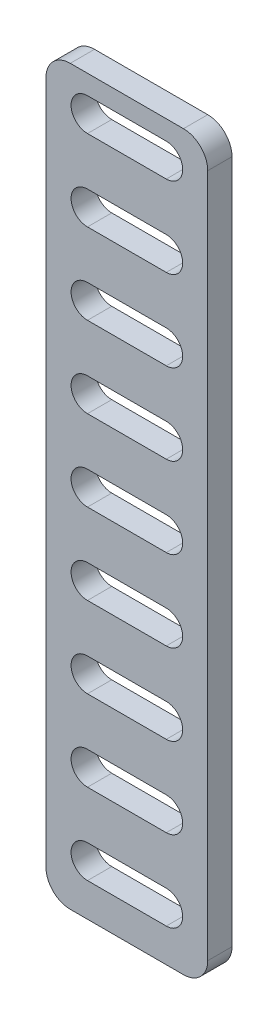
from build123d import *

# Parameters (mm, degrees)
SKETCH1_W           = 20
SKETCH1_H           = 90.600658981
BOSS_EXTRUDE1_DEPTH = 3
FILLET1_R           = 3


with BuildPart() as part:
    # Sketch1 → Boss-Extrude1 (new body)
    with BuildSketch(Plane.XY):
        with Locations((-91.066816784, 79.208884685)):
            Rectangle(SKETCH1_W, SKETCH1_H)
        with BuildLine():
            Line((-86.19596438, 38.053580074), (-95.937669189, 38.053580074))
            ThreePointArc((-95.937669189, 38.053580074), (-97.965327886, 40.081238771), (-95.937669189, 42.108897468))
            Line((-95.937669189, 42.108897468), (-86.19596438, 42.108897468))
            ThreePointArc((-86.19596438, 42.108897468), (-84.168305683, 40.081238771), (-86.19596438, 38.053580074))
        make_face(mode=Mode.SUBTRACT)
        with BuildLine():
            Line((-86.19596438, 48.053580074), (-95.937669189, 48.053580074))
            ThreePointArc((-95.937669189, 48.053580074), (-97.965327886, 50.081238771), (-95.937669189, 52.108897468))
            Line((-95.937669189, 52.108897468), (-86.19596438, 52.108897468))
            ThreePointArc((-86.19596438, 52.108897468), (-84.168305683, 50.081238771), (-86.19596438, 48.053580074))
        make_face(mode=Mode.SUBTRACT)
        with BuildLine():
            Line((-86.19596438, 58.053580074), (-95.937669189, 58.053580074))
            ThreePointArc((-95.937669189, 58.053580074), (-97.965327886, 60.081238771), (-95.937669189, 62.108897468))
            Line((-95.937669189, 62.108897468), (-86.19596438, 62.108897468))
            ThreePointArc((-86.19596438, 62.108897468), (-84.168305683, 60.081238771), (-86.19596438, 58.053580074))
        make_face(mode=Mode.SUBTRACT)
        with BuildLine():
            Line((-86.19596438, 68.053580074), (-95.937669189, 68.053580074))
            ThreePointArc((-95.937669189, 68.053580074), (-97.965327886, 70.081238771), (-95.937669189, 72.108897468))
            Line((-95.937669189, 72.108897468), (-86.19596438, 72.108897468))
            ThreePointArc((-86.19596438, 72.108897468), (-84.168305683, 70.081238771), (-86.19596438, 68.053580074))
        make_face(mode=Mode.SUBTRACT)
        with BuildLine():
            Line((-86.19596438, 78.053580074), (-95.937669189, 78.053580074))
            ThreePointArc((-95.937669189, 78.053580074), (-97.965327886, 80.081238771), (-95.937669189, 82.108897468))
            Line((-95.937669189, 82.108897468), (-86.19596438, 82.108897468))
            ThreePointArc((-86.19596438, 82.108897468), (-84.168305683, 80.081238771), (-86.19596438, 78.053580074))
        make_face(mode=Mode.SUBTRACT)
        with BuildLine():
            Line((-86.19596438, 88.053580074), (-95.937669189, 88.053580074))
            ThreePointArc((-95.937669189, 88.053580074), (-97.965327886, 90.081238771), (-95.937669189, 92.108897468))
            Line((-95.937669189, 92.108897468), (-86.19596438, 92.108897468))
            ThreePointArc((-86.19596438, 92.108897468), (-84.168305683, 90.081238771), (-86.19596438, 88.053580074))
        make_face(mode=Mode.SUBTRACT)
        with BuildLine():
            Line((-86.19596438, 98.053580074), (-95.937669189, 98.053580074))
            ThreePointArc((-95.937669189, 98.053580074), (-97.965327886, 100.081238771), (-95.937669189, 102.108897468))
            Line((-95.937669189, 102.108897468), (-86.19596438, 102.108897468))
            ThreePointArc((-86.19596438, 102.108897468), (-84.168305683, 100.081238771), (-86.19596438, 98.053580074))
        make_face(mode=Mode.SUBTRACT)
        with BuildLine():
            Line((-86.19596438, 108.053580074), (-95.937669189, 108.053580074))
            ThreePointArc((-95.937669189, 108.053580074), (-97.965327886, 110.081238771), (-95.937669189, 112.108897468))
            Line((-95.937669189, 112.108897468), (-86.19596438, 112.108897468))
            ThreePointArc((-86.19596438, 112.108897468), (-84.168305683, 110.081238771), (-86.19596438, 108.053580074))
        make_face(mode=Mode.SUBTRACT)
        with BuildLine():
            Line((-86.19596438, 118.053580074), (-95.937669189, 118.053580074))
            ThreePointArc((-95.937669189, 118.053580074), (-97.965327886, 120.081238771), (-95.937669189, 122.108897468))
            Line((-95.937669189, 122.108897468), (-86.19596438, 122.108897468))
            ThreePointArc((-86.19596438, 122.108897468), (-84.168305683, 120.081238771), (-86.19596438, 118.053580074))
        make_face(mode=Mode.SUBTRACT)
    extrude(amount=BOSS_EXTRUDE1_DEPTH)

    # Fillet1
    fillet1_edges = [part.edges().sort_by_distance(p)[0] for p in [
        (-101.066816784, 124.509214175, 1.5),
        (-81.066816784, 124.509214175, 1.5),
        (-81.066816784, 33.908555194, 1.5),
        (-101.066816784, 33.908555194, 1.5),
    ]]
    fillet(fillet1_edges, radius=FILLET1_R)


solid = part.part
